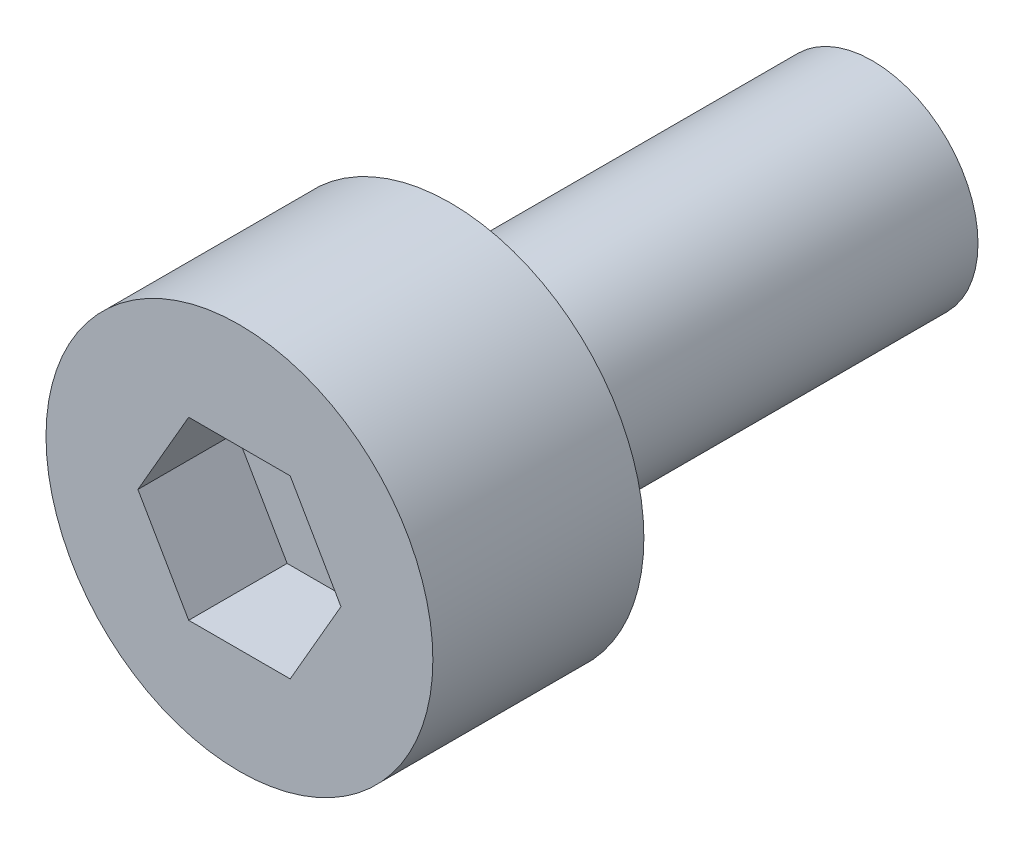
from build123d import *

# Parameters (mm, degrees)
ISO4762_HEAD_D5P5_H3_SKETCH_R       = 2.75
ISO4762_HEAD_D5P5_H3_DEPTH          = 3
M3_MAJOR_DIAMETER_ENVELOPE_START    = -6
M3_MAJOR_DIAMETER_ENVELOPE_SKETCH_R = 1.5
M3_MAJOR_DIAMETER_ENVELOPE_DEPTH    = 6
HEX_SOCKET_2P5AF_START              = 1.6
HEX_SOCKET_2P5AF_DEPTH              = 1.4


with BuildPart() as part:
    # ISO4762_head_D5p5_h3_Sketch → ISO4762_head_D5p5_h3 (new body)
    with BuildSketch(Plane.XY):
        Circle(ISO4762_HEAD_D5P5_H3_SKETCH_R)
    extrude(amount=ISO4762_HEAD_D5P5_H3_DEPTH)

    # M3_major_diameter_envelope_Sketch → M3_major_diameter_envelope (add)
    with BuildSketch(Plane.XY.offset(M3_MAJOR_DIAMETER_ENVELOPE_START)):
        Circle(M3_MAJOR_DIAMETER_ENVELOPE_SKETCH_R)
    extrude(amount=M3_MAJOR_DIAMETER_ENVELOPE_DEPTH)

    # Hex_socket_2p5AF_Sketch → Hex_socket_2p5AF (cut)
    with BuildSketch(Plane.XY.offset(HEX_SOCKET_2P5AF_START)):
        Polygon((1.443375673, 0), (0.721687836, 1.25), (-0.721687836, 1.25), (-1.443375673, 0), (-0.721687836, -1.25), (0.721687836, -1.25), align=None)
    extrude(amount=HEX_SOCKET_2P5AF_DEPTH, mode=Mode.SUBTRACT)


solid = part.part
